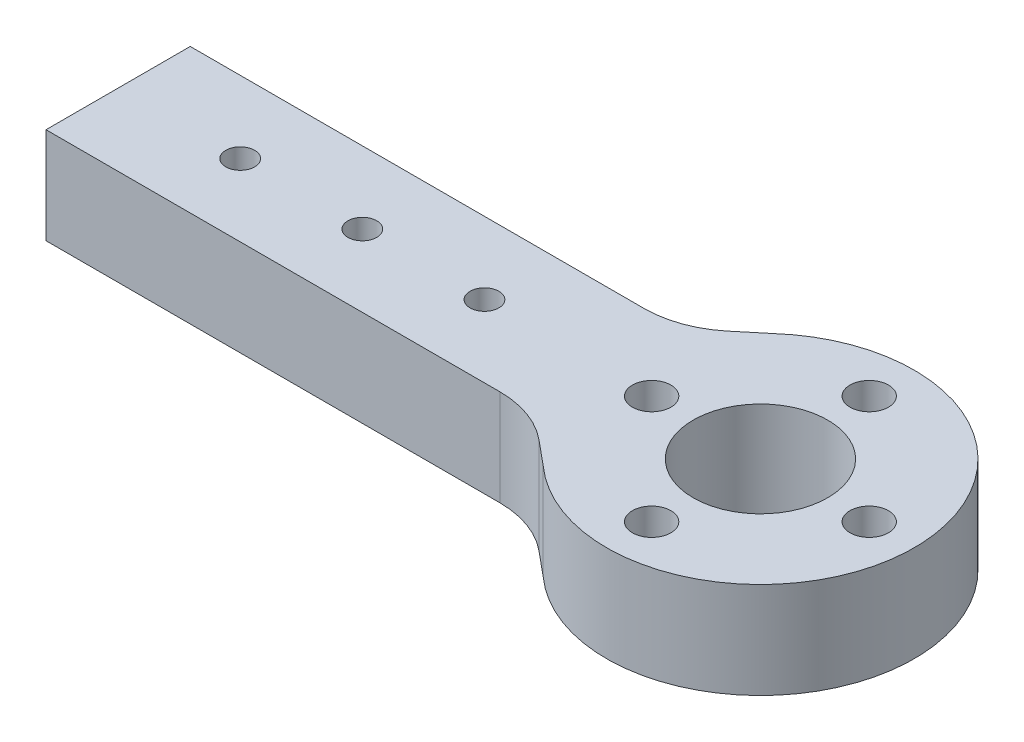
from build123d import *

# Parameters (mm, degrees)
SKETCH1_R           = 1.5
SKETCH1_R_2         = 2
SKETCH1_R_3         = 7
BOSS_EXTRUDE1_DEPTH = 10


with BuildPart() as part:
    # Sketch1 → Boss-Extrude1 (new body)
    with BuildSketch(Plane(origin=(0, 0, 0), x_dir=(1, 0, 0), z_dir=(0, 1, 0))):
        with BuildLine():
            ThreePointArc((53.57700678, 17.304163694), (50.585779575, 15.593662693), (47.191546456, 15))
            Line((47.191546456, 15), (0, 15))
            Line((0, 15), (0, 0))
            Line((0, 0), (47.191546456, 0))
            ThreePointArc((47.191546456, 0), (50.585779575, -0.593662693), (53.57700678, -2.304163694))
            Line((53.57700678, -2.304163694), (56.126078821, -4.419203273))
            ThreePointArc((56.126078821, -4.419203273), (82.8, 7.5), (56.126078821, 19.419203273))
            Line((56.126078821, 19.419203273), (53.57700678, 17.304163694))
        make_face()
        with Locations(Location((12.7, 7.5, 0), (0, 0, 270))):
            Circle(SKETCH1_R, mode=Mode.SUBTRACT)
        with Locations(Location((25.4, 7.5, 0), (0, 0, 270))):
            Circle(SKETCH1_R, mode=Mode.SUBTRACT)
        with Locations(Location((38.1, 7.5, 0), (0, 0, 270))):
            Circle(SKETCH1_R, mode=Mode.SUBTRACT)
        with BuildLine():
            ThreePointArc((53.4862915, 7.5), (55.4862915, 9.5), (57.4862915, 7.5))
            ThreePointArc((57.4862915, 7.5), (55.4862915, 5.5), (53.4862915, 7.5))
        make_face(mode=Mode.SUBTRACT)
        with Locations(Location((66.8, -3.8137085, 0), (0, 0, 270))):
            Circle(SKETCH1_R_2, mode=Mode.SUBTRACT)
        with Locations(Location((66.8, 18.8137085, 0), (0, 0, 270))):
            Circle(SKETCH1_R_2, mode=Mode.SUBTRACT)
        with Locations(Location((78.1137085, 7.5, 0), (0, 0, 270))):
            Circle(SKETCH1_R_2, mode=Mode.SUBTRACT)
        with Locations(Location((66.8, 7.5, 0), (0, 0, 270))):
            Circle(SKETCH1_R_3, mode=Mode.SUBTRACT)
    extrude(amount=BOSS_EXTRUDE1_DEPTH)


solid = part.part
